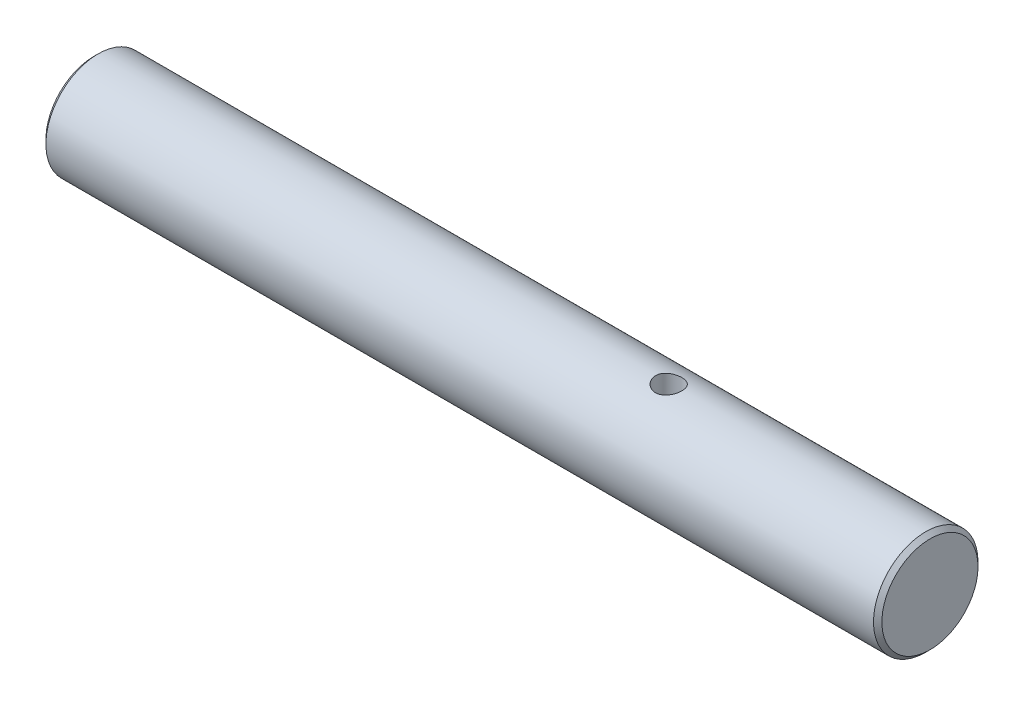
from build123d import *

# Parameters (mm, degrees)
SKETCH1_R               = 3.175
BOSS_EXTRUDE1_DEPTH     = 50.8
CHAMFER1_SIZE           = 0.254
CUT_EXTRUDE1_DEPTH      = 51.998051433
CUT_EXTRUDE1_DEPTH_BACK = 51.998051433
SKETCH2_R               = 0.8001


with BuildPart() as part:
    # Sketch1 → Boss-Extrude1 (new body)
    with BuildSketch(Plane(origin=(0, 0, 0), x_dir=(0, 0, -1), z_dir=(1, 0, 0))):
        Circle(SKETCH1_R)
    extrude(amount=-BOSS_EXTRUDE1_DEPTH)

    # Chamfer1
    chamfer1_edges = [part.edges().sort_by_distance(p)[0] for p in [
        (0, 0, 3.175),
        (-50.8, 0, 3.175),
    ]]
    chamfer(chamfer1_edges, length=CHAMFER1_SIZE)

    # Sketch2 → Cut-Extrude1 (cut, two sides: drawn at the far end of the back side and taken through both)
    with BuildSketch(Plane(origin=(0, 0, 0), x_dir=(1, 0, 0), z_dir=(0, 1, 0)).offset(-CUT_EXTRUDE1_DEPTH_BACK)):
        with Locations(Location((-15.875, 0, 0), (0, 0, 270))):
            Circle(SKETCH2_R)
    extrude(amount=CUT_EXTRUDE1_DEPTH + CUT_EXTRUDE1_DEPTH_BACK, mode=Mode.SUBTRACT)


solid = part.part
